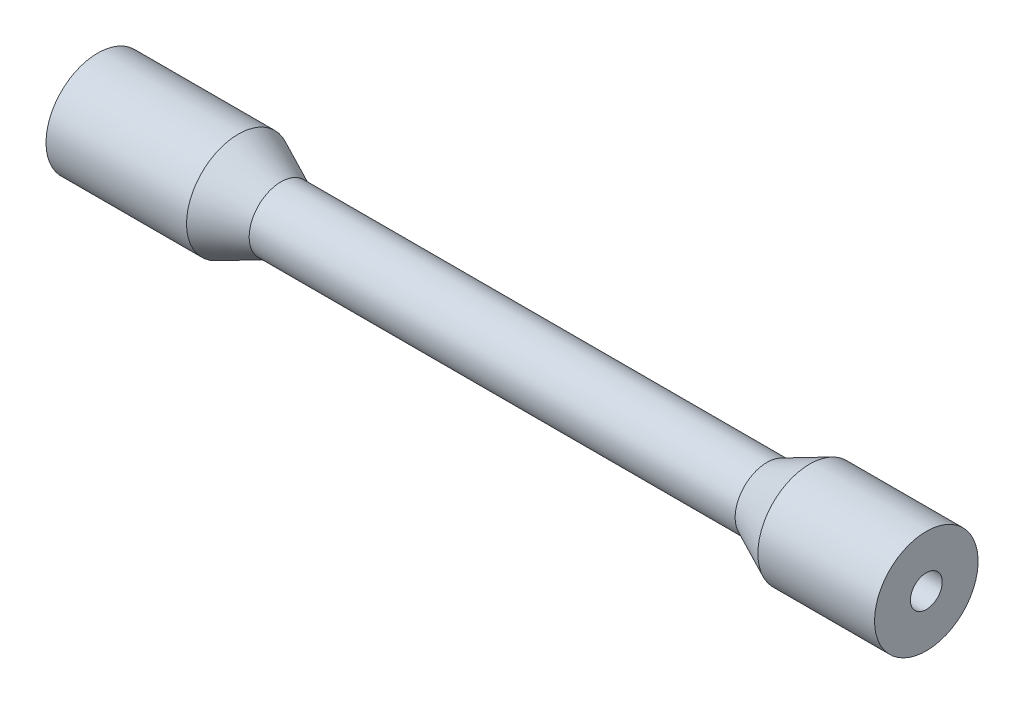
from build123d import *

# Parameters (mm, degrees)
SKETCH_1_R      = 3.25
SKETCH_1_R_2    = 1
EXTRUDE_1_DEPTH = 26


with BuildPart() as part:
    # 草图1 → 凸台-拉伸1 (new, symmetric)
    with BuildSketch(Plane(origin=(0, 0, 0), x_dir=(0, 0, -1), z_dir=(1, 0, 0))):
        with Locations(Location((0, 0, 0), (0, 0, 180))):
            Circle(SKETCH_1_R)
        with Locations(Location((0, 0, 0), (0, 0, 180))):
            Circle(SKETCH_1_R_2, mode=Mode.SUBTRACT)
    extrude(amount=EXTRUDE_1_DEPTH, both=True)

    # 草图2 → 切除-旋转1 (revolve, cut)
    with BuildSketch(Plane.XY, mode=Mode.PRIVATE) as cut_revolve_1_sk:
        Polygon((-17.180633651, 3.25), (18.680633651, 3.25), (16, 2), (-14.5, 2), align=None)
    revolve(cut_revolve_1_sk.sketch.rotate(Axis((-26, 0, 0), (1, 0, 0)), 90), axis=Axis((-26, 0, 0), (1, 0, 0)), mode=Mode.SUBTRACT)


solid = part.part
